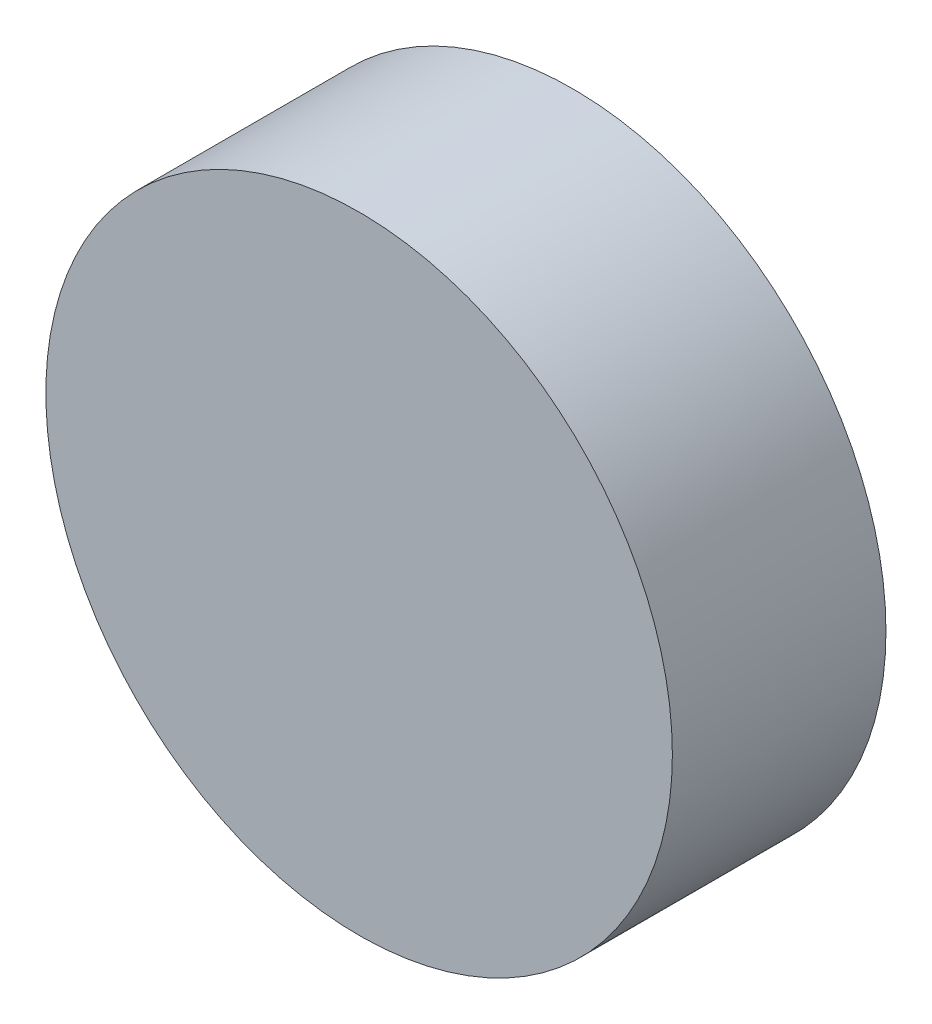
from build123d import *

# Parameters (mm, degrees)
SKETCH1_R           = 22
BOSS_EXTRUDE1_DEPTH = 15
SKETCH2_R           = 10
CUT_EXTRUDE1_DEPTH  = 5
SKETCH3_R           = 17.075773731
SKETCH3_R_2         = 14.593062164
CUT_EXTRUDE2_DEPTH  = 8


with BuildPart() as part:
    # Sketch1 → Boss-Extrude1 (new body)
    with BuildSketch(Plane.XY):
        Circle(SKETCH1_R)
    extrude(amount=BOSS_EXTRUDE1_DEPTH)

    # Sketch2 → Cut-Extrude1 (cut)
    with BuildSketch(Plane(origin=(0, 0, 0), x_dir=(-1, 0, 0), z_dir=(0, 0, -1))):
        Circle(SKETCH2_R)
    extrude(amount=-CUT_EXTRUDE1_DEPTH, mode=Mode.SUBTRACT)

    # Sketch3 → Cut-Extrude2 (cut)
    with BuildSketch(Plane(origin=(0, 0, 0), x_dir=(-1, 0, 0), z_dir=(0, 0, -1))):
        Circle(SKETCH3_R)
        Circle(SKETCH3_R_2, mode=Mode.SUBTRACT)
    extrude(amount=-CUT_EXTRUDE2_DEPTH, mode=Mode.SUBTRACT)


solid = part.part
